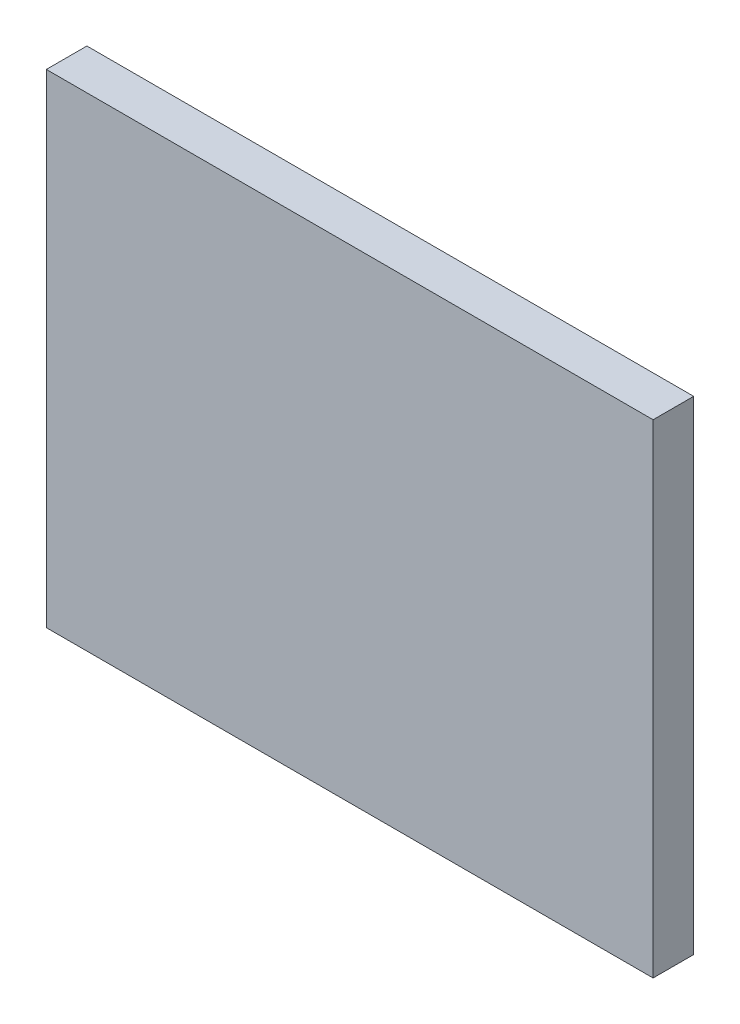
from build123d import *

# Parameters (mm, degrees)
SKETCH1_W           = 47.498
SKETCH1_H           = 37.846
BOSS_EXTRUDE1_DEPTH = 3.175


with BuildPart() as part:
    # Sketch1 → Boss-Extrude1 (new body)
    with BuildSketch(Plane.XY):
        Rectangle(SKETCH1_W, SKETCH1_H)
    extrude(amount=BOSS_EXTRUDE1_DEPTH)


solid = part.part
